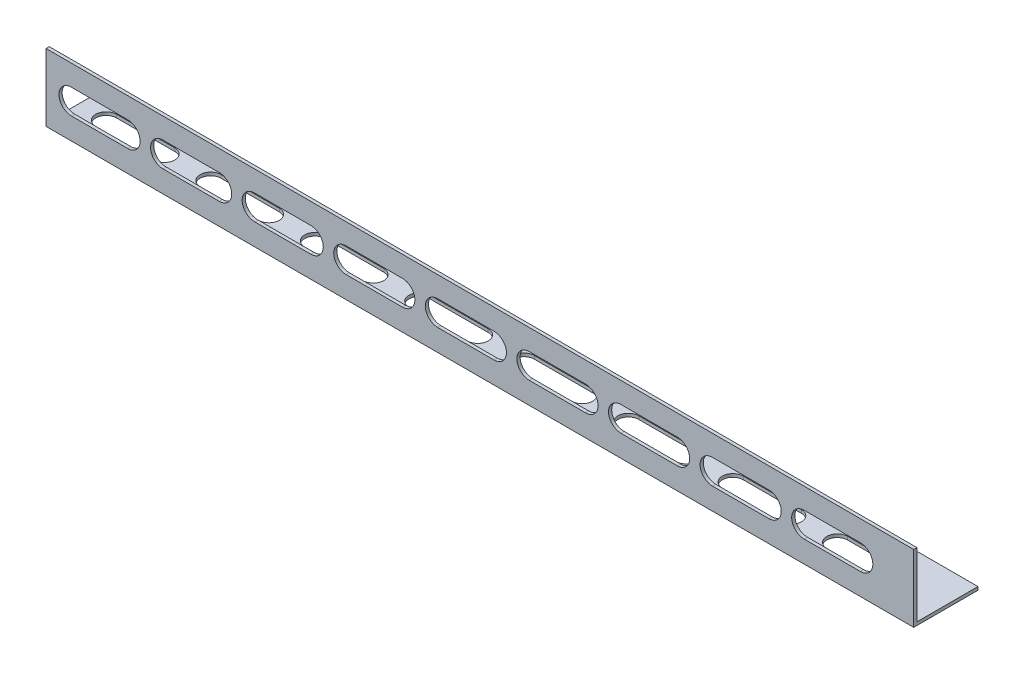
from build123d import *

# Parameters (mm, degrees)
SKETCH1_W           = 150
SKETCH1_H           = 40
BOSS_EXTRUDE1_DEPTH = 2
SKETCH2_W           = 150
SKETCH2_H           = 2
BOSS_EXTRUDE2_DEPTH = 40
BOSS_EXTRUDE3_DEPTH = 390
CUT_EXTRUDE1_DEPTH  = 10
CUT_EXTRUDE2_DEPTH  = 10


with BuildPart() as part:
    # Sketch1 → Boss-Extrude1 (new body)
    with BuildSketch(Plane(origin=(0, 0, 0), x_dir=(1, 0, 0), z_dir=(0, 1, 0))):
        Rectangle(SKETCH1_W, SKETCH1_H)
    extrude(amount=BOSS_EXTRUDE1_DEPTH)

    # Sketch2 → Boss-Extrude2 (add)
    with BuildSketch(Plane(origin=(0, 2, 0), x_dir=(1, 0, 0), z_dir=(0, 1, 0))):
        with Locations((0, -19)):
            Rectangle(SKETCH2_W, SKETCH2_H)
    extrude(amount=BOSS_EXTRUDE2_DEPTH)

    # Sketch5 → Boss-Extrude3 (add)
    with BuildSketch(Plane(origin=(75, 0, 0), x_dir=(0, 0, -1), z_dir=(1, 0, 0))):
        Polygon((-20, 0), (20, 0), (20, 2), (-18, 2), (-18, 42), (-20, 42), align=None)
    extrude(amount=BOSS_EXTRUDE3_DEPTH)

    # Sketch6 → Cut-Extrude1 (cut)
    with BuildSketch(Plane.XZ):
        with BuildLine():
            Line((7.420621343, 6.493750786), (43.697093864, 6.493750786))
            ThreePointArc((43.697093864, 6.493750786), (50.190844651, 0), (43.697093864, -6.493750786))
            Line((43.697093864, -6.493750786), (7.420621343, -6.493750786))
            ThreePointArc((7.420621343, -6.493750786), (0.926870557, 0), (7.420621343, 6.493750786))
        make_face()
        with BuildLine():
            Line((-57.579378657, 6.493750786), (-21.302906136, 6.493750786))
            ThreePointArc((-21.302906136, 6.493750786), (-14.809155349, 0), (-21.302906136, -6.493750786))
            Line((-21.302906136, -6.493750786), (-57.579378657, -6.493750786))
            ThreePointArc((-57.579378657, -6.493750786), (-64.073129443, 0), (-57.579378657, 6.493750786))
        make_face()
        with BuildLine():
            Line((72.420621343, 6.493750786), (108.697093864, 6.493750786))
            ThreePointArc((108.697093864, 6.493750786), (115.190844651, 0), (108.697093864, -6.493750786))
            Line((108.697093864, -6.493750786), (72.420621343, -6.493750786))
            ThreePointArc((72.420621343, -6.493750786), (65.926870557, 0), (72.420621343, 6.493750786))
        make_face()
        with BuildLine():
            Line((137.420621343, 6.493750786), (173.697093864, 6.493750786))
            ThreePointArc((173.697093864, 6.493750786), (180.190844651, 0), (173.697093864, -6.493750786))
            Line((173.697093864, -6.493750786), (137.420621343, -6.493750786))
            ThreePointArc((137.420621343, -6.493750786), (130.926870557, 0), (137.420621343, 6.493750786))
        make_face()
        with BuildLine():
            Line((202.420621343, 6.493750786), (238.697093864, 6.493750786))
            ThreePointArc((238.697093864, 6.493750786), (245.190844651, 0), (238.697093864, -6.493750786))
            Line((238.697093864, -6.493750786), (202.420621343, -6.493750786))
            ThreePointArc((202.420621343, -6.493750786), (195.926870557, 0), (202.420621343, 6.493750786))
        make_face()
        with BuildLine():
            Line((267.420621343, 6.493750786), (303.697093864, 6.493750786))
            ThreePointArc((303.697093864, 6.493750786), (310.190844651, 0), (303.697093864, -6.493750786))
            Line((303.697093864, -6.493750786), (267.420621343, -6.493750786))
            ThreePointArc((267.420621343, -6.493750786), (260.926870557, 0), (267.420621343, 6.493750786))
        make_face()
        with BuildLine():
            Line((332.420621343, 6.493750786), (368.697093864, 6.493750786))
            ThreePointArc((368.697093864, 6.493750786), (375.190844651, 0), (368.697093864, -6.493750786))
            Line((368.697093864, -6.493750786), (332.420621343, -6.493750786))
            ThreePointArc((332.420621343, -6.493750786), (325.926870557, 0), (332.420621343, 6.493750786))
        make_face()
        with BuildLine():
            Line((397.420621343, 6.493750786), (433.697093864, 6.493750786))
            ThreePointArc((433.697093864, 6.493750786), (440.190844651, 0), (433.697093864, -6.493750786))
            Line((433.697093864, -6.493750786), (397.420621343, -6.493750786))
            ThreePointArc((397.420621343, -6.493750786), (390.926870557, 0), (397.420621343, 6.493750786))
        make_face()
    extrude(amount=-CUT_EXTRUDE1_DEPTH, mode=Mode.SUBTRACT)

    # Sketch7 → Cut-Extrude2 (cut)
    with BuildSketch(Plane.XY.offset(20)):
        with BuildLine():
            Line((-2.201358411, 29.022590271), (32.798641589, 29.022590271))
            ThreePointArc((32.798641589, 29.022590271), (40.548675365, 21.272556495), (32.798641589, 13.522522718))
            Line((32.798641589, 13.522522718), (-2.201358411, 13.522522718))
            ThreePointArc((-2.201358411, 13.522522718), (-9.951392188, 21.272556495), (-2.201358411, 29.022590271))
        make_face()
        with BuildLine():
            Line((-59.201358411, 29.022590271), (-24.201358411, 29.022590271))
            ThreePointArc((-24.201358411, 29.022590271), (-16.451324635, 21.272556495), (-24.201358411, 13.522522718))
            Line((-24.201358411, 13.522522718), (-59.201358411, 13.522522718))
            ThreePointArc((-59.201358411, 13.522522718), (-66.951392188, 21.272556495), (-59.201358411, 29.022590271))
        make_face()
        with BuildLine():
            Line((54.798641589, 29.022590271), (89.798641589, 29.022590271))
            ThreePointArc((89.798641589, 29.022590271), (97.548675365, 21.272556495), (89.798641589, 13.522522718))
            Line((89.798641589, 13.522522718), (54.798641589, 13.522522718))
            ThreePointArc((54.798641589, 13.522522718), (47.048607812, 21.272556495), (54.798641589, 29.022590271))
        make_face()
        with BuildLine():
            Line((111.798641589, 29.022590271), (146.798641589, 29.022590271))
            ThreePointArc((146.798641589, 29.022590271), (154.548675365, 21.272556495), (146.798641589, 13.522522718))
            Line((146.798641589, 13.522522718), (111.798641589, 13.522522718))
            ThreePointArc((111.798641589, 13.522522718), (104.048607812, 21.272556495), (111.798641589, 29.022590271))
        make_face()
        with BuildLine():
            Line((168.798641589, 29.022590271), (203.798641589, 29.022590271))
            ThreePointArc((203.798641589, 29.022590271), (211.548675365, 21.272556495), (203.798641589, 13.522522718))
            Line((203.798641589, 13.522522718), (168.798641589, 13.522522718))
            ThreePointArc((168.798641589, 13.522522718), (161.048607812, 21.272556495), (168.798641589, 29.022590271))
        make_face()
        with BuildLine():
            Line((225.798641589, 29.022590271), (260.798641589, 29.022590271))
            ThreePointArc((260.798641589, 29.022590271), (268.548675365, 21.272556495), (260.798641589, 13.522522718))
            Line((260.798641589, 13.522522718), (225.798641589, 13.522522718))
            ThreePointArc((225.798641589, 13.522522718), (218.048607812, 21.272556495), (225.798641589, 29.022590271))
        make_face()
        with BuildLine():
            Line((282.798641589, 29.022590271), (317.798641589, 29.022590271))
            ThreePointArc((317.798641589, 29.022590271), (325.548675365, 21.272556495), (317.798641589, 13.522522718))
            Line((317.798641589, 13.522522718), (282.798641589, 13.522522718))
            ThreePointArc((282.798641589, 13.522522718), (275.048607812, 21.272556495), (282.798641589, 29.022590271))
        make_face()
        with BuildLine():
            Line((339.798641589, 29.022590271), (374.798641589, 29.022590271))
            ThreePointArc((374.798641589, 29.022590271), (382.548675365, 21.272556495), (374.798641589, 13.522522718))
            Line((374.798641589, 13.522522718), (339.798641589, 13.522522718))
            ThreePointArc((339.798641589, 13.522522718), (332.048607812, 21.272556495), (339.798641589, 29.022590271))
        make_face()
        with BuildLine():
            Line((396.798641589, 29.022590271), (431.798641589, 29.022590271))
            ThreePointArc((431.798641589, 29.022590271), (439.548675365, 21.272556495), (431.798641589, 13.522522718))
            Line((431.798641589, 13.522522718), (396.798641589, 13.522522718))
            ThreePointArc((396.798641589, 13.522522718), (389.048607812, 21.272556495), (396.798641589, 29.022590271))
        make_face()
    extrude(amount=-CUT_EXTRUDE2_DEPTH, mode=Mode.SUBTRACT)


solid = part.part
